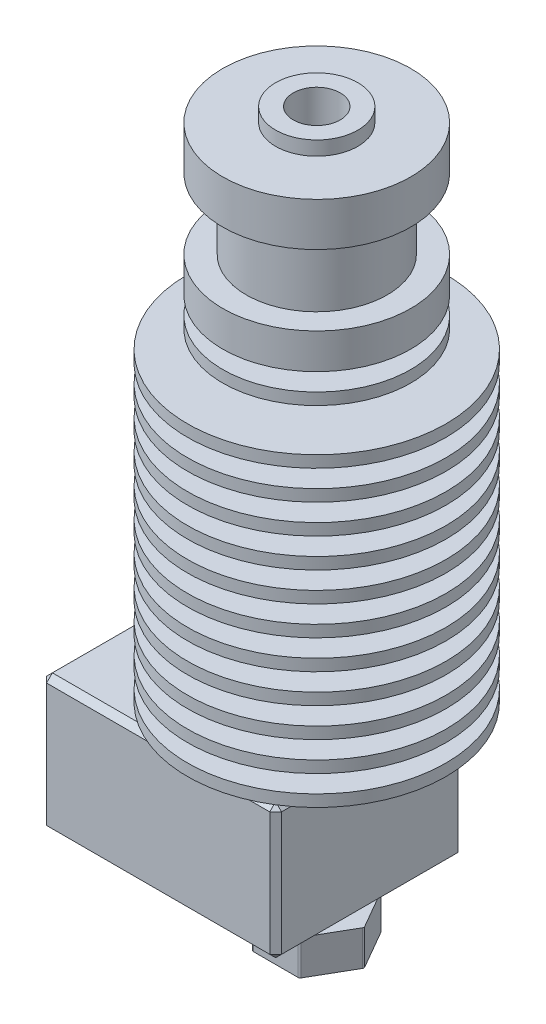
from build123d import *

# Parameters (mm, degrees)
SKETCH2_R           = 3.5
BOSS_EXTRUDE1_DEPTH = 1.2
SKETCH3_R           = 0.875
CUT_EXTRUDE1_DEPTH  = 47.574778582
SKETCH10_R          = 2
CUT_EXTRUDE4_DEPTH  = 33.9
SKETCH6_OUTSIDE_W   = 38.142
SKETCH6_OUTSIDE_H   = 38.142
CUT_EXTRUDE2_DEPTH  = 3
FILLET1_R           = 0.2
BOSS_EXTRUDE2_START = 1.5
SKETCH7_W           = 20
SKETCH7_H           = 16
BOSS_EXTRUDE2_DEPTH = 11.5
CHAMFER2_SIZE       = 0.5
SKETCH8_R           = 0.2
CUT_EXTRUDE3_DEPTH  = 67.283482105
SKETCH9_W           = 1.6
SKETCH9_H           = 1.6


with BuildPart() as part:
    # Sketch1 → Revolve1 (revolve)
    with BuildSketch(Plane.XY):
        Polygon((0, 0), (-8, 0), (-8, -3.7), (-6, -3.7), (-6, -9.7), (-8, -9.7), (-8, -12.7), (-4, -12.7), (-4, -14.2), (-8, -14.2), (-8, -15.2), (-4, -15.2), (-4, -16.7), (-11, -16.7), (-11, -17.7), (-3, -17.7), (-3, -19.2), (-11, -19.2), (-11, -20.2), (-3, -20.2), (-3, -21.7), (-11, -21.7), (-11, -22.7), (-3, -22.7), (-3, -24.2), (-11, -24.2), (-11, -25.2), (-3, -25.2), (-3, -26.7), (-11, -26.7), (-11, -27.7), (-3, -27.7), (-3, -29.2), (-11, -29.2), (-11, -30.2), (-3, -30.2), (-3, -31.7), (-11, -31.7), (-11, -32.7), (-3, -32.7), (-3, -34.2), (-11, -34.2), (-11, -35.2), (-3, -35.2), (-3, -36.7), (-11, -36.7), (-11, -37.7), (-3, -37.7), (-3, -39.2), (-11, -39.2), (-11, -40.2), (-3, -40.2), (-3, -41.7), (-11, -41.7), (-11, -42.7), (0, -42.7), align=None)
    revolve(axis=Axis((0, 0, 0), (0, -1, 0)))

    # Sketch2 → Boss-Extrude1 (add)
    with BuildSketch(Plane(origin=(0, 0, 0), x_dir=(1, 0, 0), z_dir=(0, 1, 0))):
        with Locations(Location((0, 0, 0), (0, 0, 180))):
            Circle(SKETCH2_R)
    extrude(amount=BOSS_EXTRUDE1_DEPTH)

    # Sketch3 → Cut-Extrude1 (cut, through all)
    with BuildSketch(Plane(origin=(0, 1.2, 0), x_dir=(1, 0, 0), z_dir=(0, 1, 0))):
        with Locations(Location((0, 0, 0), (0, 0, 180))):
            Circle(SKETCH3_R)
    extrude(amount=-CUT_EXTRUDE1_DEPTH, mode=Mode.SUBTRACT)

    # Sketch10 → Cut-Extrude4 (cut)
    with BuildSketch(Plane(origin=(0, 1.2, 0), x_dir=(1, 0, 0), z_dir=(0, 1, 0))):
        with Locations(Location((0, 0, 0), (0, 0, 180))):
            Circle(SKETCH10_R)
    extrude(amount=-CUT_EXTRUDE4_DEPTH, mode=Mode.SUBTRACT)

    # Sketch5 → Revolve2 (revolve)
    with BuildSketch(Plane.XY, mode=Mode.PRIVATE) as revolve2_sk:
        Polygon((0, -42.7), (-2.5, -42.7), (-2.5, -57.3), (-5, -57.3), (-5, -60.3), (-1.715415076, -60.3), (-0.315, -62.3), (0, -62.3), align=None)
    revolve(revolve2_sk.sketch.rotate(Axis((0, -62.3, 0), (0, 1, 0)), 270), axis=Axis((0, -62.3, 0), (0, 1, 0)))

    # Sketch6 outside → Cut-Extrude2 (cut)
    with BuildSketch(Plane.XZ.offset(60.3)):
        Rectangle(SKETCH6_OUTSIDE_W, SKETCH6_OUTSIDE_H)
        Polygon((2.020725942, 3.5), (-2.020725942, 3.5), (-4.041451884, 0), (-2.020725942, -3.5), (2.020725942, -3.5), (4.041451884, 0), align=None, mode=Mode.SUBTRACT)
    extrude(amount=-CUT_EXTRUDE2_DEPTH, mode=Mode.SUBTRACT)

    # Fillet1
    fillet1_edges = [part.edges().sort_by_distance(p)[0] for p in [
        (2.020725942, -58.8, 3.5),
        (-2.020725942, -58.8, 3.5),
        (-4.041451884, -58.8, 0),
        (-2.020725942, -58.8, -3.5),
        (2.020725942, -58.8, -3.5),
        (4.041451884, -58.8, 0),
    ]]
    fillet(fillet1_edges, radius=FILLET1_R)

    # Sketch7 → Boss-Extrude2 (add)
    with BuildSketch(Plane(origin=(0, -57.3, 0), x_dir=(1, 0, 0), z_dir=(0, 1, 0)).offset(BOSS_EXTRUDE2_START)):
        with Locations((-5.5, 0)):
            Rectangle(SKETCH7_W, SKETCH7_H)
    extrude(amount=BOSS_EXTRUDE2_DEPTH)

    # Chamfer2
    chamfer2_edges = [part.edges().sort_by_distance(p)[0] for p in [
        (4.5, -55.8, 0),
        (4.5, -50.05, 8),
        (-5.5, -55.8, -8),
        (4.5, -50.05, -8),
        (-15.5, -55.8, 0),
        (-15.5, -50.05, -8),
        (-5.5, -55.8, 8),
        (-15.5, -50.05, 8),
        (4.5, -44.3, 0),
        (-5.5, -44.3, -8),
        (-15.5, -44.3, 0),
        (-5.5, -44.3, 8),
    ]]
    chamfer(chamfer2_edges, length=CHAMFER2_SIZE)

    # Sketch8 → Cut-Extrude3 (cut, through all)
    with BuildSketch(Plane.XZ.offset(62.3)):
        with Locations(Location((0, 0, 0), (0, 0, 270))):
            Circle(SKETCH8_R)
    extrude(amount=-CUT_EXTRUDE3_DEPTH, mode=Mode.SUBTRACT)

    # Sketch9 → Cut-Revolve1 (revolve, cut)
    with BuildSketch(Plane.XY, mode=Mode.PRIVATE) as cut_revolve1_sk:
        with Locations((-2.2, -43.5)):
            Rectangle(SKETCH9_W, SKETCH9_H)
    revolve(cut_revolve1_sk.sketch.rotate(Axis((0, -42.7, 0), (0, -1, 0)), 270), axis=Axis((0, -42.7, 0), (0, -1, 0)), mode=Mode.SUBTRACT)


solid = part.part
